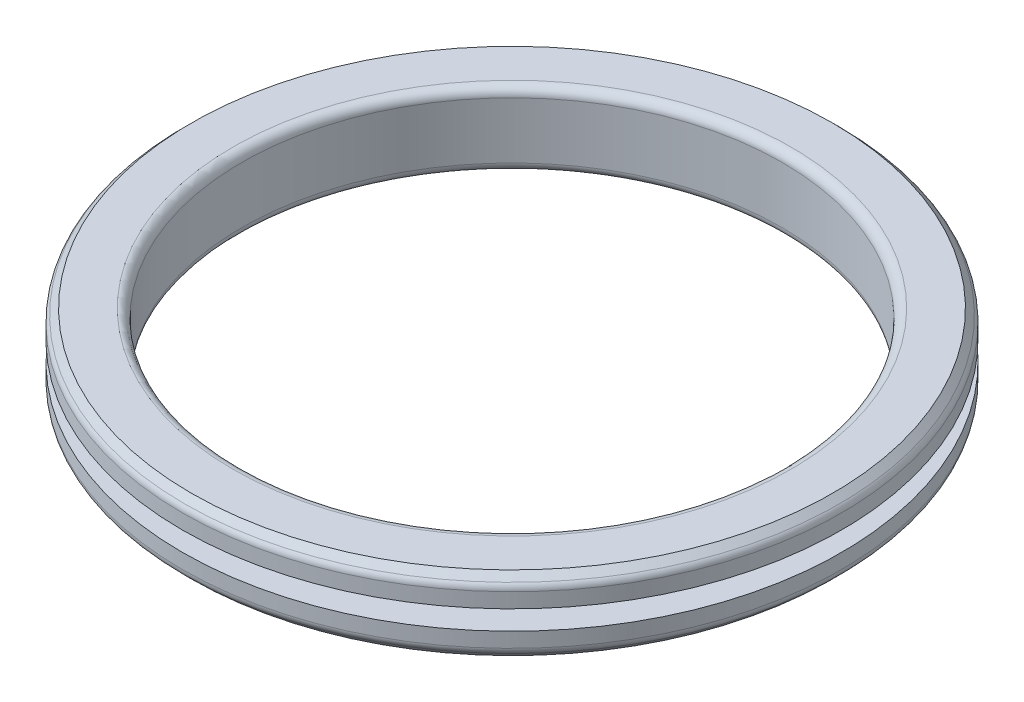
from build123d import *

# Parameters (mm, degrees)
SKETCH1_R           = 11.1
SKETCH1_R_2         = 9.1
BOSS_EXTRUDE1_DEPTH = 2.5
CHAMFER1_SIZE       = 0.3
FILLET1_R           = 0.3
FILLET2_R           = 0.3
SKETCH7_W           = 1.941178579
SKETCH7_H           = 0.651471862


with BuildPart() as part:
    # Sketch1 → Boss-Extrude1 (new body)
    with BuildSketch(Plane(origin=(0, 0, 0), x_dir=(1, 0, 0), z_dir=(0, 1, 0))):
        with Locations(Location((0, 0, 0), (0, 0, 270))):
            Circle(SKETCH1_R)
        with Locations(Location((0, 0, 0), (0, 0, 270))):
            Circle(SKETCH1_R_2, mode=Mode.SUBTRACT)
    extrude(amount=BOSS_EXTRUDE1_DEPTH)

    # Chamfer1
    chamfer1_edges = [part.edges().sort_by_distance(p)[0] for p in [
        (0, 0, -11.1),
        (0, 2.5, -11.1),
    ]]
    chamfer(chamfer1_edges, length=CHAMFER1_SIZE)

    # Fillet1
    fillet1_edges = [part.edges().sort_by_distance(p)[0] for p in [
        (0, 0, -9.1),
        (0, 2.5, -9.1),
    ]]
    fillet(fillet1_edges, radius=FILLET1_R)

    # Fillet2
    fillet2_edges = [part.edges().sort_by_distance(p)[0] for p in [
        (0, 0.3, -11.1),
        (0, 2.2, -11.1),
    ]]
    fillet(fillet2_edges, radius=FILLET2_R)

    # Sketch7 → Cut-Revolve3 (revolve, cut)
    with BuildSketch(Plane(origin=(0, 0, 0), x_dir=(0, 0, -1), z_dir=(1, 0, 0)), mode=Mode.PRIVATE) as cut_revolve3_sk:
        with Locations((-11.07058929, 1.25)):
            Rectangle(SKETCH7_W, SKETCH7_H)
    revolve(cut_revolve3_sk.sketch.rotate(Axis((0, -4.292585454, 0), (0, 1, 0)), 180), axis=Axis((0, -4.292585454, 0), (0, 1, 0)), mode=Mode.SUBTRACT)


solid = part.part
